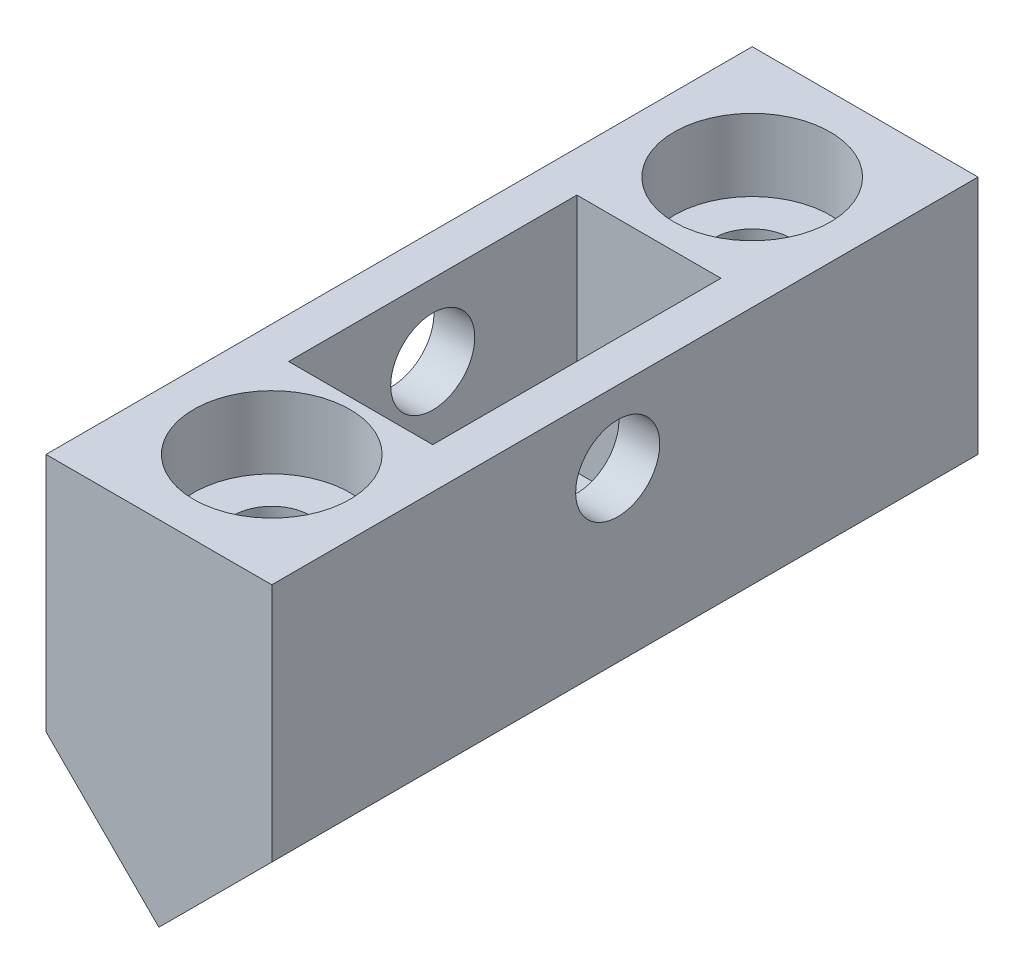
from build123d import *

# Parameters (mm, degrees)
BOSS_EXTRUDE1_DEPTH            = 14.4
BOSS_EXTRUDE1_DEPTH_BACK       = 15
SKETCH2_W                      = 6
SKETCH2_H                      = 12
CUT_EXTRUDE1_DEPTH             = 10
SKETCH3_R                      = 1.75
CUT_EXTRUDE2_DEPTH             = 21.185390757
CBORE_FOR_M3_SHCS1_D           = 3.2
CBORE_FOR_M3_SHCS1_CBORE_D     = 6.5
CBORE_FOR_M3_SHCS1_CBORE_DEPTH = 3


with BuildPart() as part:
    # Sketch1 → Boss-Extrude1 (new, two sides: drawn at the far end of the back side and taken through both)
    with BuildSketch(Plane.XY.offset(-BOSS_EXTRUDE1_DEPTH_BACK)):
        Polygon((-4.7, 5), (4.7, 5), (4.7, -5), (0, -9.7), (-4.7, -5), align=None)
    extrude(amount=BOSS_EXTRUDE1_DEPTH + BOSS_EXTRUDE1_DEPTH_BACK)

    # Sketch2 → Cut-Extrude1 (cut)
    with BuildSketch(Plane(origin=(0, 5, 0), x_dir=(1, 0, 0), z_dir=(0, 1, 0))):
        Rectangle(SKETCH2_W, SKETCH2_H)
    extrude(amount=-CUT_EXTRUDE1_DEPTH, mode=Mode.SUBTRACT)

    # Sketch3 → Cut-Extrude2 (cut, through all)
    with BuildSketch(Plane(origin=(4.7, 0, 0), x_dir=(0, 0, -1), z_dir=(1, 0, 0))):
        with Locations(Location((0, 2, 0), (0, 0, 90))):
            Circle(SKETCH3_R)
    extrude(amount=-CUT_EXTRUDE2_DEPTH, mode=Mode.SUBTRACT)

    # CBORE for M3 SHCS1 (through all)
    with Locations(Plane(origin=(0, 5, 0), x_dir=(1, 0, 0), z_dir=(0, 1, 0))):
        with Locations((0, -9.7), (0, 10.3)):
            CounterBoreHole(CBORE_FOR_M3_SHCS1_D / 2, CBORE_FOR_M3_SHCS1_CBORE_D / 2, CBORE_FOR_M3_SHCS1_CBORE_DEPTH)


solid = part.part
